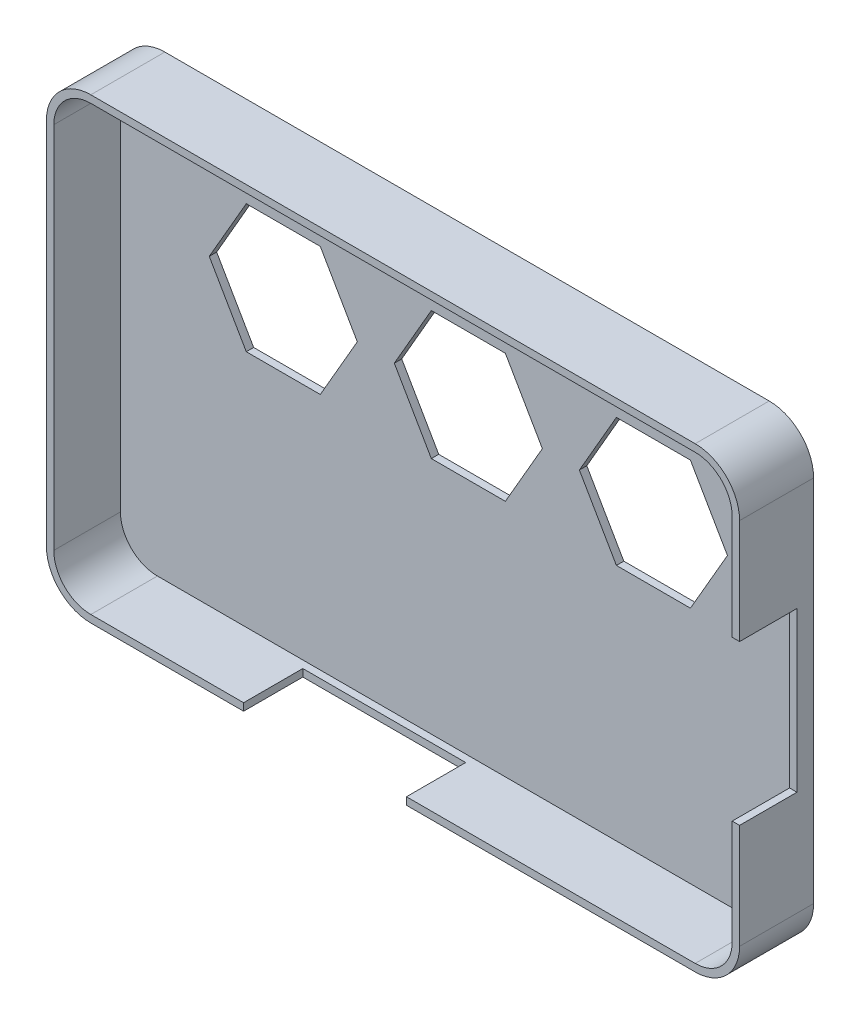
from build123d import *

# Parameters (mm, degrees)
SKIZZE1_W                       = 61.8
SKIZZE1_H                       = 93.64
AUFSATZ_LINEAR_AUSTRAGEN1_DEPTH = 10
VERRUNDUNG1_R                   = 6
WANDUNG1_T                      = -1
SKIZZE2_W                       = 21.5
SKIZZE2_H                       = 15.5
SCHNITT_LINEAR_AUSTRAGEN1_DEPTH = 6
SKIZZE3_W                       = 22
SKIZZE3_H                       = 8
SCHNITT_LINEAR_AUSTRAGEN2_DEPTH = 6
SCHNITT_LINEAR_AUSTRAGEN4_DEPTH = 6
LINEARES_MUSTER1_COUNT          = 3
LINEARES_MUSTER1_PITCH          = 25


with BuildPart() as part:
    # Skizze1 → Aufsatz-Linear austragen1 (new body)
    with BuildSketch(Plane(origin=(0, 0, 0), x_dir=(0, 1, 0), z_dir=(0, 0, 1))):
        Rectangle(SKIZZE1_W, SKIZZE1_H)
    extrude(amount=AUFSATZ_LINEAR_AUSTRAGEN1_DEPTH)

    # Verrundung1
    verrundung1_edges = [part.edges().sort_by_distance(p)[0] for p in [
        (46.82, 30.9, 5),
        (46.82, -30.9, 5),
        (-46.82, -30.9, 5),
        (-46.82, 30.9, 5),
    ]]
    fillet(verrundung1_edges, radius=VERRUNDUNG1_R)

    # Wandung1
    wandung1_openings = [part.faces().sort_by_distance(p)[0] for p in [
        (0, 0, 10),
    ]]
    offset(amount=WANDUNG1_T, openings=wandung1_openings, kind=Kind.INTERSECTION)

    # Skizze2 → Schnitt-Linear austragen1 (cut)
    with BuildSketch(Plane.YZ.offset(46.82)):
        with Locations((0, 10)):
            Rectangle(SKIZZE2_W, SKIZZE2_H)
    extrude(amount=-SCHNITT_LINEAR_AUSTRAGEN1_DEPTH, mode=Mode.SUBTRACT)

    # Skizze3 → Schnitt-Linear austragen2 (cut)
    with BuildSketch(Plane.XZ.offset(30.9)):
        with Locations((-9.18, 6)):
            Rectangle(SKIZZE3_W, SKIZZE3_H)
    extrude(amount=-SCHNITT_LINEAR_AUSTRAGEN2_DEPTH, mode=Mode.SUBTRACT)

    # Skizze4 → Schnitt-Linear austragen4 (cut)
    with BuildSketch(Plane(origin=(0, 0, 0), x_dir=(1, 0, 0), z_dir=(0, 0, -1))):
        Polygon((-18.82, -2.339745962), (-28.82, -2.339745962), (-33.82, -11), (-28.82, -19.660254038), (-18.82, -19.660254038), (-13.82, -11), align=None)
    schnitt_linear_austragen4 = extrude(amount=-SCHNITT_LINEAR_AUSTRAGEN4_DEPTH, mode=Mode.SUBTRACT)

    # Lineares Muster1: Schnitt-Linear austragen4 ×3
    with Locations(*[(i * LINEARES_MUSTER1_PITCH, 0, 0) for i in range(1, LINEARES_MUSTER1_COUNT)]):
        add(schnitt_linear_austragen4, mode=Mode.SUBTRACT)


solid = part.part
